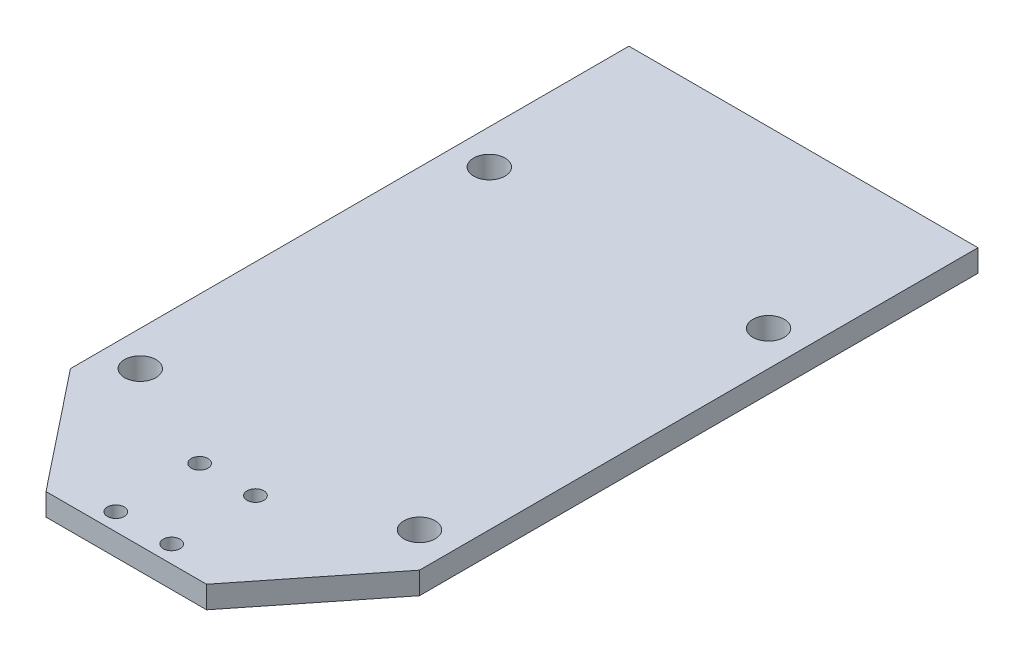
from build123d import *

# Parameters (mm, degrees)
SKETCH1_W            = 50
SKETCH1_H            = 80
SKETCH1_W_2          = 23
SKETCH1_H_2          = 17
BOSS_EXTRUDE1_DEPTH  = 1.5875
M2_CLEARANCE_HOLE1_D = 2.4
M4_CLEARANCE_HOLE1_D = 4.5


with BuildPart() as part:
    # Sketch1 → Boss-Extrude1 (new, symmetric)
    with BuildSketch(Plane(origin=(0, 0, 0), x_dir=(1, 0, 0), z_dir=(0, 1, 0))):
        Polygon((-25, -40), (-11.5, -57), (-11.5, -40), align=None)
        Polygon((11.5, -40), (11.5, -57), (25, -40), align=None)
        Rectangle(SKETCH1_W, SKETCH1_H)
        with Locations((0, -48.5)):
            Rectangle(SKETCH1_W_2, SKETCH1_H_2)
    extrude(amount=BOSS_EXTRUDE1_DEPTH, both=True)

    # M2 Clearance Hole1 (through all)
    with Locations(Plane(origin=(0, 1.5875, 0), x_dir=(1, 0, 0), z_dir=(0, 1, 0))):
        with Locations((-4, -54.5), (4, -54.5), (4, -42.5), (-4, -42.5)):
            Hole(M2_CLEARANCE_HOLE1_D / 2)

    # M4 Clearance Hole1 (through all)
    with Locations(Plane(origin=(0, 1.5875, 0), x_dir=(1, 0, 0), z_dir=(0, 1, 0))):
        with Locations((-20, 15), (20, 15), (20, -35), (-20, -35)):
            Hole(M4_CLEARANCE_HOLE1_D / 2)


solid = part.part
